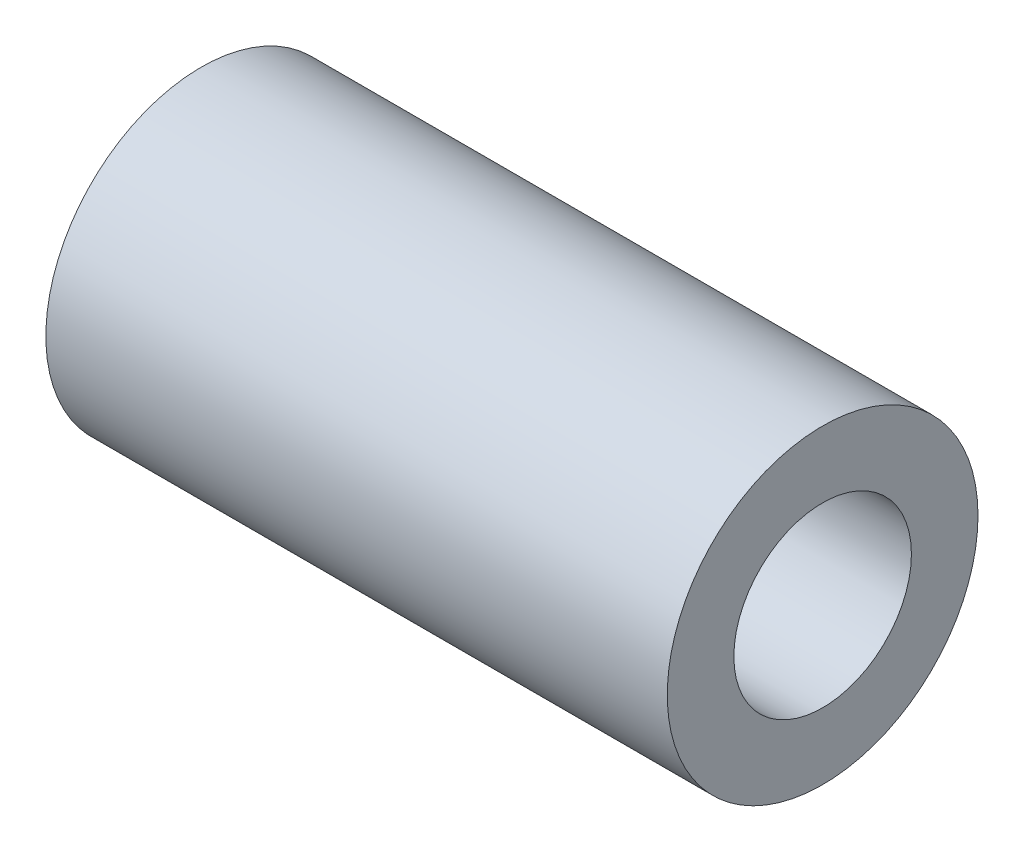
from build123d import *

# Parameters (mm, degrees)
SKETCH1_R           = 7
SKETCH1_R_2         = 4
BOSS_EXTRUDE1_DEPTH = 14


with BuildPart() as part:
    # Sketch1 → Boss-Extrude1 (new, symmetric)
    with BuildSketch(Plane(origin=(0, 0, 0), x_dir=(0, 0, -1), z_dir=(1, 0, 0))):
        Circle(SKETCH1_R)
        Circle(SKETCH1_R_2, mode=Mode.SUBTRACT)
    extrude(amount=BOSS_EXTRUDE1_DEPTH, both=True)


solid = part.part
